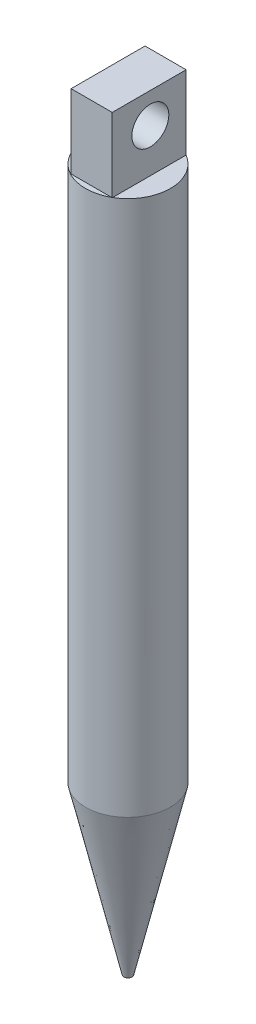
from build123d import *

# Parameters (mm, degrees)
ESQUISSE1_W             = 4.45
ESQUISSE1_H             = 8
BOSS_EXTRU_1_DEPTH      = 8
ESQUISSE2_R             = 4.597869413
BOSS_EXTRU_2_DEPTH      = 58
ESQUISSE4_R             = 2
ENL_V_MAT_EXTRU_1_DEPTH = 18
ESQUISSE5_R             = 4.597869413
BOSS_EXTRU_3_DEPTH      = 18
BOSS_EXTRU_3_TAPER      = 13


with BuildPart() as part:
    # Esquisse1 → Boss.-Extru.1 (new body)
    with BuildSketch(Plane.XY):
        with Locations((0.087605016, -1.300333333)):
            Rectangle(ESQUISSE1_W, ESQUISSE1_H)
    extrude(amount=BOSS_EXTRU_1_DEPTH)

    # Esquisse2 → Boss.-Extru.2 (add)
    with BuildSketch(Plane.XZ.offset(5.300333333)):
        with Locations(Location((0, 3.983435039, 0), (0, 0, 60.876291729))):
            Circle(ESQUISSE2_R)
    extrude(amount=BOSS_EXTRU_2_DEPTH)

    # Esquisse4 → Enlèv. mat.-Extru.1 (cut)
    with BuildSketch(Plane(origin=(2.312605016, 0, 0), x_dir=(0, 0, -1), z_dir=(1, 0, 0))):
        with Locations(Location((-3.87570667, -0.589342017, 0), (0, 0, 90))):
            Circle(ESQUISSE4_R)
    extrude(amount=-ENL_V_MAT_EXTRU_1_DEPTH, mode=Mode.SUBTRACT)

    # Esquisse5 → Boss.-Extru.3 (add)
    with BuildSketch(Plane.XZ.offset(63.300333333)):
        with Locations(Location((0, 3.983435039, 0), (0, 0, 60.876291729))):
            Circle(ESQUISSE5_R)
    extrude(amount=BOSS_EXTRU_3_DEPTH, taper=BOSS_EXTRU_3_TAPER)


solid = part.part
